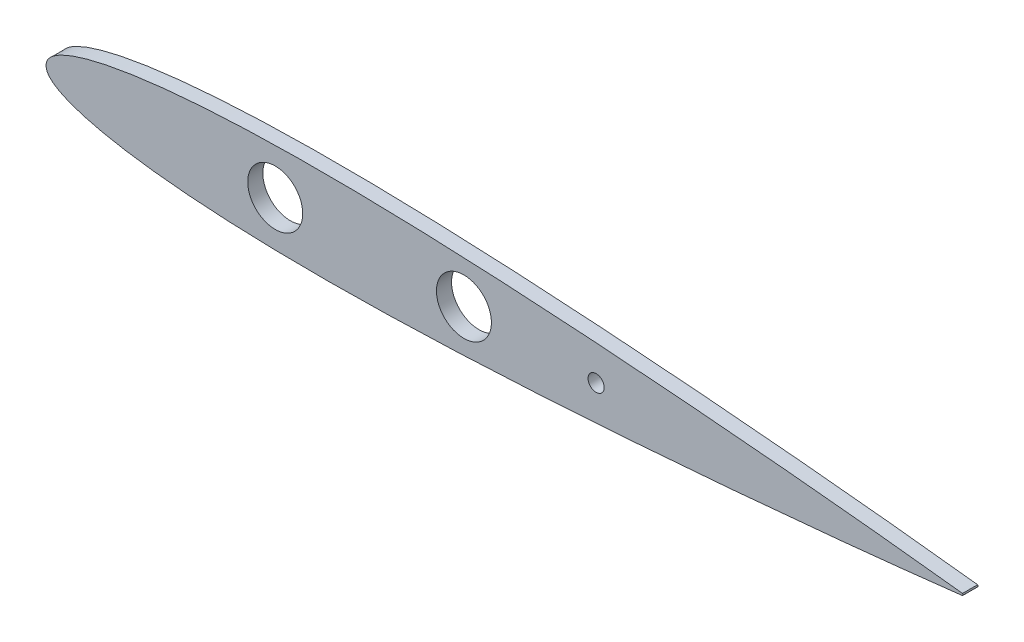
from build123d import *

# Parameters (mm, degrees)
SKETCH_1_R      = 5.1
SKETCH_1_R_2    = 1.5
EXTRUDE_1_DEPTH = 1.4


with BuildPart() as part:
    # Эскиз1 → Бобышка-Вытянуть1 (new, symmetric)
    # profile 1 of 4: a face of its own
    with BuildSketch(Plane.XY):
        with BuildLine():
            Line((205.582632617, 0), (205.582632617, 6.886761457))
            add(Edge.make_bspline(
                [(205.582632617, 6.886761457), (204.140626106, 6.977565841), (201.051989696, 7.166067783), (196.331634567, 7.433105337), (191.441311474, 7.684604439), (186.608700127, 7.906218293), (181.844626933, 8.095958493), (177.159453511, 8.251957682), (172.563150272, 8.372486564), (168.065295924, 8.455953662), (163.675147454, 8.5010027), (159.401643404, 8.506522967), (155.253439756, 8.471528808), (151.238917925, 8.395506076), (147.366223919, 8.277985977), (143.643266298, 8.118975561), (140.077743555, 7.918678943), (136.677139412, 7.677604542), (133.448762895, 7.396480569), (130.399721686, 7.07642431), (127.536961089, 6.718650341), (124.867245825, 6.324666077), (122.397158974, 5.896120566), (120.133109351, 5.434797476), (118.081312133, 4.942567641), (116.247665798, 4.421392386), (114.63793972, 3.873060466), (113.256788366, 3.299309238), (112.109835923, 2.701306388), (111.196336341, 2.078555233), (110.530223642, 1.427069758), (110.085538218, 0.73423022), (110.027578176, 0.23672144), (110, 0)],
                knots=[0.433307728, 0.433307728, 0.433307728, 0.433307728, 0.458441906, 0.487136113, 0.515551917, 0.543623846, 0.571289984, 0.59849081, 0.625169613, 0.651272029, 0.676746158, 0.701541791, 0.725611017, 0.748907835, 0.771387785, 0.793008139, 0.813728033, 0.833507815, 0.852309696, 0.87009731, 0.886835918, 0.902492782, 0.917037139, 0.930441054, 0.942679762, 0.953733567, 0.963589785, 0.972247019, 0.979722225, 0.986065145, 0.991385258, 0.995900989, 1, 1, 1, 1], degree=3))
            add(Edge.make_bspline(
                [(110, 0), (110.027578176, -0.23672144), (110.085538218, -0.73423022), (110.530223642, -1.427069758), (111.196336341, -2.078555233), (112.109835923, -2.701306388), (113.256788366, -3.299309238), (114.63793972, -3.873060466), (116.247665798, -4.421392386), (118.081312133, -4.942567641), (120.133109351, -5.434797476), (122.397158974, -5.896120566), (124.867245825, -6.324666077), (127.536961089, -6.718650341), (130.399721686, -7.07642431), (133.448762895, -7.396480569), (136.677139412, -7.677604542), (140.077743555, -7.918678943), (143.643266298, -8.118975561), (147.366223919, -8.277985977), (151.238917925, -8.395506076), (155.253439756, -8.471528808), (159.401643404, -8.506522967), (163.675147454, -8.5010027), (168.065295924, -8.455953662), (172.563150272, -8.372486564), (177.159453511, -8.251957682), (181.844626933, -8.095958493), (186.608700127, -7.906218293), (191.441311474, -7.684604439), (196.331634567, -7.433105337), (201.051989696, -7.166067783), (204.140626106, -6.977565841), (205.582632617, -6.886761457)],
                knots=[0, 0, 0, 0, 0.004099011, 0.008614742, 0.013934855, 0.020277775, 0.027752981, 0.036410215, 0.046266433, 0.057320238, 0.069558946, 0.082962861, 0.097507218, 0.113164082, 0.12990269, 0.147690304, 0.166492185, 0.186271967, 0.206991861, 0.228612215, 0.251092165, 0.274388983, 0.298458209, 0.323253842, 0.348727971, 0.374830387, 0.40150919, 0.428710016, 0.456376154, 0.484448083, 0.512863887, 0.541558094, 0.566692272, 0.566692272, 0.566692272, 0.566692272], degree=3))
            Line((205.582632617, -6.886761457), (205.582632617, 0))
        make_face()
        with Locations((152.51848428, 0)):
            Circle(SKETCH_1_R, mode=Mode.SUBTRACT)
        with Locations((187.51848428, 0)):
            Circle(SKETCH_1_R, mode=Mode.SUBTRACT)
    # profile 2 of 4: a face of its own
    with BuildSketch(Plane.XY):
        with BuildLine():
            ThreePointArc((212.044362273, 6.461729655), (207.475229415, 4.569132857), (205.582632617, 0))
            ThreePointArc((205.582632617, 0), (207.475229415, -4.569132857), (212.044362273, -6.461729655))
            add(Edge.make_bspline(
                [(212.044362273, -6.461729655), (213.441768986, -6.366013574), (216.506779643, -6.150829329), (221.232257467, -5.802244475), (226.209311114, -5.416958265), (231.150377303, -5.017351103), (236.038226964, -4.605811749), (240.854179313, -4.184912649), (247.071089236, -3.62220531), (253.116111921, -3.047869044), (258.952644662, -2.467188138), (263.047743378, -2.047856604), (266.898988862, -1.642607304), (270.455833183, -1.258590905), (273.651166984, -0.905304265), (276.385426802, -0.596436482), (278.45259621, -0.358958361), (279.592043704, -0.226075898), (280, -0.1785)],
                knots=[0.604241732, 0.604241732, 0.604241732, 0.604241732, 0.628607349, 0.657690446, 0.686667237, 0.715444849, 0.743923546, 0.77199483, 0.799540253, 0.852512115, 0.877624446, 0.901571134, 0.924121062, 0.944988816, 0.963803939, 0.980044339, 0.992855276, 1, 1, 1, 1], degree=3))
            ThreePointArc((280, -0.1785), (280.073937121, 0), (280, 0.1785))
            add(Edge.make_bspline(
                [(280, 0.1785), (279.592043704, 0.226075898), (278.45259621, 0.358958361), (276.385426802, 0.596436482), (273.651166984, 0.905304265), (270.455833183, 1.258590905), (266.898988862, 1.642607304), (263.047743378, 2.047856604), (258.952644662, 2.467188138), (253.116111921, 3.047869044), (247.071089236, 3.62220531), (240.854179313, 4.184912649), (236.038226964, 4.605811749), (231.150377303, 5.017351103), (226.209311114, 5.416958265), (221.232257467, 5.802244475), (216.506779643, 6.150829329), (213.441768986, 6.366013574), (212.044362273, 6.461729655)],
                knots=[0, 0, 0, 0, 0.007144724, 0.019955661, 0.036196061, 0.055011184, 0.075878938, 0.098428866, 0.122375554, 0.147487885, 0.200459747, 0.22800517, 0.256076454, 0.284555151, 0.313332763, 0.342309554, 0.371392651, 0.395758268, 0.395758268, 0.395758268, 0.395758268], degree=3))
        make_face()
        with Locations((212.044362273, 0)):
            Circle(SKETCH_1_R_2, mode=Mode.SUBTRACT)
    # profile 3 of 4: a face of its own
    with BuildSketch(Plane.XY):
        with BuildLine():
            add(Edge.make_bspline(
                [(212.044362273, 6.461729655), (211.772660016, 6.480340039), (209.83531282, 6.612395131), (207.681394056, 6.754052774), (205.798928695, 6.873141107), (205.582632617, 6.886761457)],
                knots=[0.395758268, 0.395758268, 0.395758268, 0.395758268, 0.400495752, 0.429537687, 0.433307728, 0.433307728, 0.433307728, 0.433307728], degree=3))
            Line((205.582632617, 6.886761457), (205.582632617, 0))
            ThreePointArc((205.582632617, 0), (207.475229415, 4.569132857), (212.044362273, 6.461729655))
        make_face()
    # profile 4 of 4: a face of its own
    with BuildSketch(Plane.XY):
        with BuildLine():
            ThreePointArc((212.044362273, -6.461729655), (207.475229415, -4.569132857), (205.582632617, 0))
            Line((205.582632617, 0), (205.582632617, -6.886761457))
            add(Edge.make_bspline(
                [(205.582632617, -6.886761457), (205.798928695, -6.873141107), (207.681394056, -6.754052774), (209.83531282, -6.612395131), (211.772660016, -6.480340039), (212.044362273, -6.461729655)],
                knots=[0.566692272, 0.566692272, 0.566692272, 0.566692272, 0.570462313, 0.599504248, 0.604241732, 0.604241732, 0.604241732, 0.604241732], degree=3))
        make_face()
    extrude(amount=EXTRUDE_1_DEPTH, both=True)


solid = part.part
